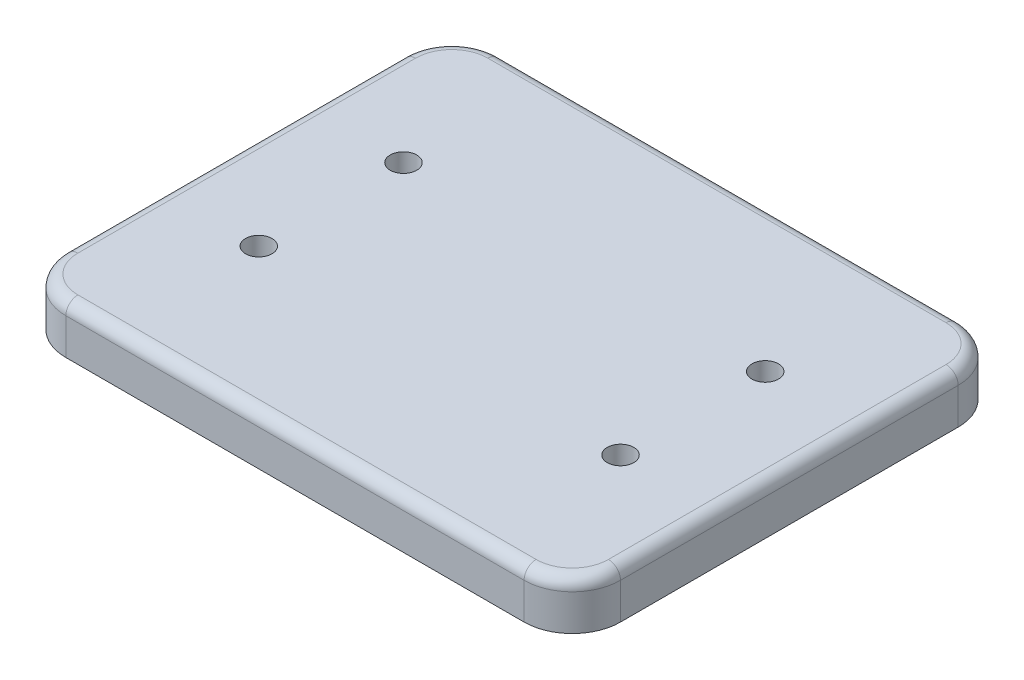
from build123d import *

# Parameters (mm, degrees)
BOSS_EXTRUDE1_DEPTH = 20
FILLET1_R           = 5
SKETCH2_R           = 5.5
CUT_EXTRUDE1_DEPTH  = 20
SKETCH3_R           = 9
CUT_EXTRUDE2_DEPTH  = 11


with BuildPart() as part:
    # Sketch1 → Boss-Extrude1 (new body)
    with BuildSketch(Plane(origin=(0, 0, 0), x_dir=(1, 0, 0), z_dir=(0, 1, 0))):
        with BuildLine():
            Line((95, -90), (-95, -90))
            ThreePointArc((-95, -90), (-109.142135624, -84.142135624), (-115, -70))
            Line((-115, -70), (-115, 70))
            ThreePointArc((-115, 70), (-109.142135624, 84.142135624), (-95, 90))
            Line((-95, 90), (95, 90))
            ThreePointArc((95, 90), (109.142135624, 84.142135624), (115, 70))
            Line((115, 70), (115, -70))
            ThreePointArc((115, -70), (109.142135624, -84.142135624), (95, -90))
        make_face()
    extrude(amount=BOSS_EXTRUDE1_DEPTH)

    # Fillet1
    fillet1_edges = [part.edges().sort_by_distance(p)[0] for p in [
        (109.142135624, 20, 84.142135624),
        (115, 20, 0),
        (109.142135624, 20, -84.142135624),
        (0, 20, -90),
        (-109.142135624, 20, -84.142135624),
        (-115, 20, 0),
        (-109.142135624, 20, 84.142135624),
        (0, 20, 90),
    ]]
    fillet(fillet1_edges, radius=FILLET1_R)

    # Sketch2 → Cut-Extrude1 (cut)
    with BuildSketch(Plane(origin=(0, 20, 0), x_dir=(1, 0, 0), z_dir=(0, 1, 0))):
        with Locations(Location((-75, 30, 0), (0, 0, 270))):
            Circle(SKETCH2_R)
        with Locations(Location((75, 30, 0), (0, 0, 270))):
            Circle(SKETCH2_R)
    cut_extrude1 = extrude(amount=-CUT_EXTRUDE1_DEPTH, mode=Mode.SUBTRACT)

    # Sketch3 → Cut-Extrude2 (cut)
    with BuildSketch(Plane.XZ):
        with Locations(Location((-75, -30, 0), (0, 0, 270))):
            Circle(SKETCH3_R)
        with Locations(Location((75, -30, 0), (0, 0, 270))):
            Circle(SKETCH3_R)
    cut_extrude2 = extrude(amount=-CUT_EXTRUDE2_DEPTH, mode=Mode.SUBTRACT)

    # Mirror1: Cut-Extrude1, Cut-Extrude2 across plane
    add(cut_extrude1.mirror(Plane.XY), mode=Mode.SUBTRACT)
    add(cut_extrude2.mirror(Plane.XY), mode=Mode.SUBTRACT)


solid = part.part
